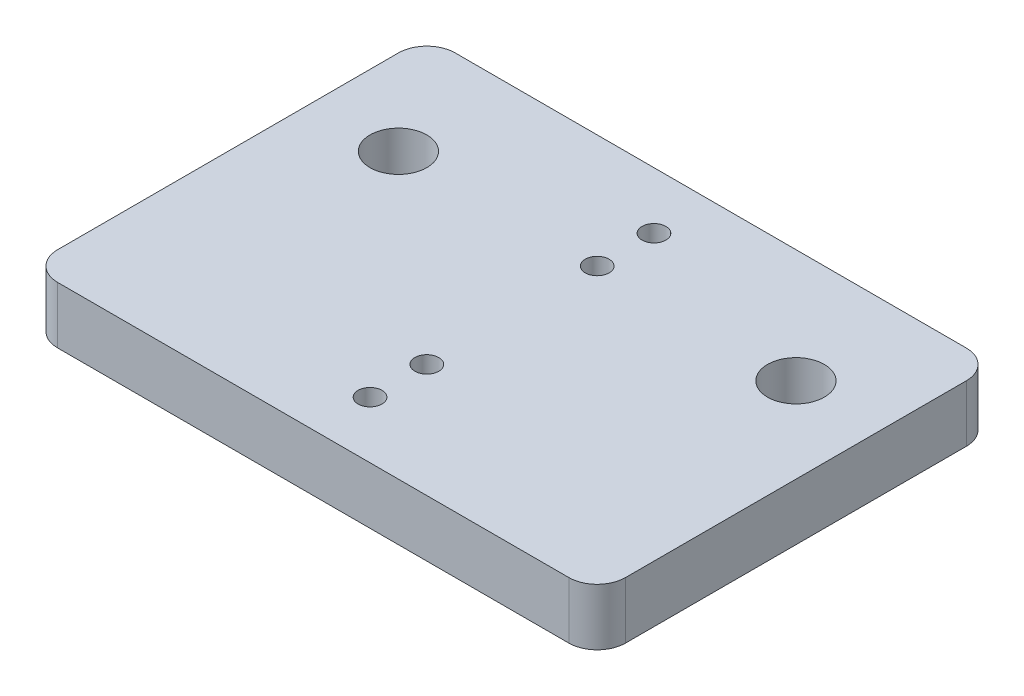
from build123d import *

# Parameters (mm, degrees)
SKETCH2_W           = 127
SKETCH2_H           = 88.9
SKETCH2_R           = 6.35
SKETCH2_R_2         = 2.667
BOSS_EXTRUDE1_DEPTH = 12.7
FILLET1_R           = 6.35


with BuildPart() as part:
    # Sketch2 → Boss-Extrude1 (new body)
    with BuildSketch(Plane(origin=(0, 0, 0), x_dir=(1, 0, 0), z_dir=(0, 1, 0))):
        with Locations((0, -5.297057788)):
            Rectangle(SKETCH2_W, SKETCH2_H)
        with Locations(Location((-44.45, 13.752942212, 0), (0, 0, 270))):
            Circle(SKETCH2_R, mode=Mode.SUBTRACT)
        with Locations(Location((0, 26.452942212, 0), (0, 0, 270))):
            Circle(SKETCH2_R_2, mode=Mode.SUBTRACT)
        with Locations(Location((0, 13.752942212, 0), (0, 0, 270))):
            Circle(SKETCH2_R_2, mode=Mode.SUBTRACT)
        with Locations(Location((44.45, 13.752942212, 0), (0, 0, 270))):
            Circle(SKETCH2_R, mode=Mode.SUBTRACT)
        with Locations(Location((0, -37.047057788, 0), (0, 0, 270))):
            Circle(SKETCH2_R_2, mode=Mode.SUBTRACT)
        with Locations(Location((0, -24.347057788, 0), (0, 0, 270))):
            Circle(SKETCH2_R_2, mode=Mode.SUBTRACT)
    extrude(amount=BOSS_EXTRUDE1_DEPTH)

    # Fillet1
    fillet1_edges = [part.edges().sort_by_distance(p)[0] for p in [
        (-63.5, 6.35, 49.747057788),
        (-63.5, 6.35, -39.152942212),
        (63.5, 6.35, -39.152942212),
        (63.5, 6.35, 49.747057788),
    ]]
    fillet(fillet1_edges, radius=FILLET1_R)


solid = part.part
